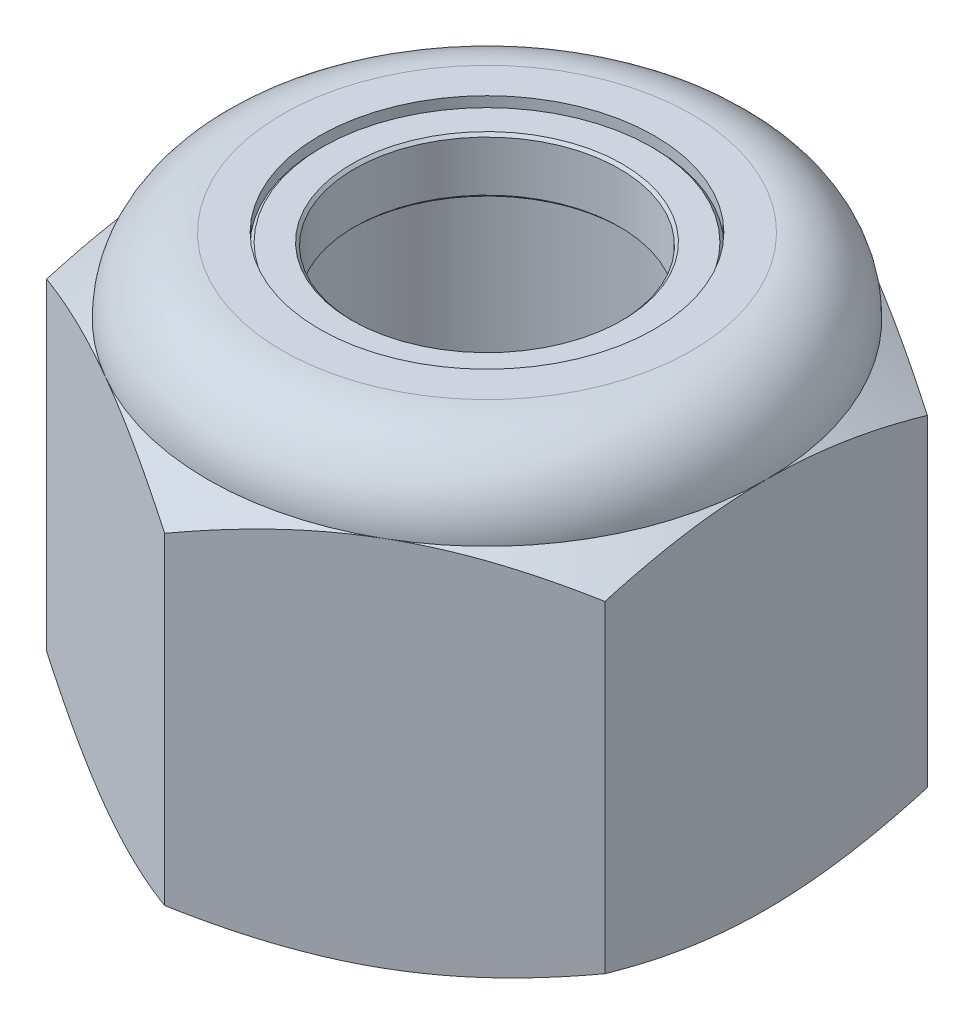
from build123d import *

# Parameters (mm, degrees)
SKETCH1_R           = 3
EXTRUDE1_DEPTH      = 8
EXTRUDE_THIN1_START = -0.15
SKETCH3_R           = 3
SKETCH3_R_2         = 2.375
EXTRUDE_THIN1_DEPTH = 1
CHAMFER1_SIZE       = 0.05


with BuildPart() as part:
    # Sketch1 → Extrude1 (new body)
    with BuildSketch(Plane(origin=(0, 0, 0), x_dir=(1, 0, 0), z_dir=(0, 1, 0))):
        Polygon((0, 5.773502692), (-5, 2.886751346), (-5, -2.886751346), (0, -5.773502692), (5, -2.886751346), (5, 2.886751346), align=None)
        Circle(SKETCH1_R, mode=Mode.SUBTRACT)
    extrude(amount=EXTRUDE1_DEPTH)

    # Sketch2 → Cut-Revolve1 (revolve, cut)
    with BuildSketch(Plane(origin=(0, 0, 0), x_dir=(0, 0, -1), z_dir=(1, 0, 0))):
        with BuildLine():
            Line((5.773502692, 8), (5.773502692, 6.220084679))
            Line((5.773502692, 6.220084679), (5, 6.666666667))
            ThreePointArc((5, 6.666666667), (4.609475708, 7.609475708), (3.666666667, 8))
            Line((3.666666667, 8), (5.773502692, 8))
        make_face()
        Polygon((5.773502692, 0.446581987), (5, 0), (5.773502692, 0), align=None)
    revolve(axis=Axis((0, 0, 0), (0, 1, 0)), mode=Mode.SUBTRACT)


with BuildPart() as body_2:
    # Sketch3 → Extrude-Thin1 (new body)
    with BuildSketch(Plane(origin=(0, 8, 0), x_dir=(1, 0, 0), z_dir=(0, 1, 0)).offset(EXTRUDE_THIN1_START)):
        Circle(SKETCH3_R)
        Circle(SKETCH3_R_2, mode=Mode.SUBTRACT)
    extrude(amount=-EXTRUDE_THIN1_DEPTH)

    # Chamfer1
    chamfer1_edges = [body_2.edges().sort_by_distance(p)[0] for p in [
        (-3, 7.85, 0),
        (-2.375, 7.85, 0),
        (-3, 6.85, 0),
        (-2.375, 6.85, 0),
    ]]
    chamfer(chamfer1_edges, length=CHAMFER1_SIZE)


solid = Compound([part.part, body_2.part])
